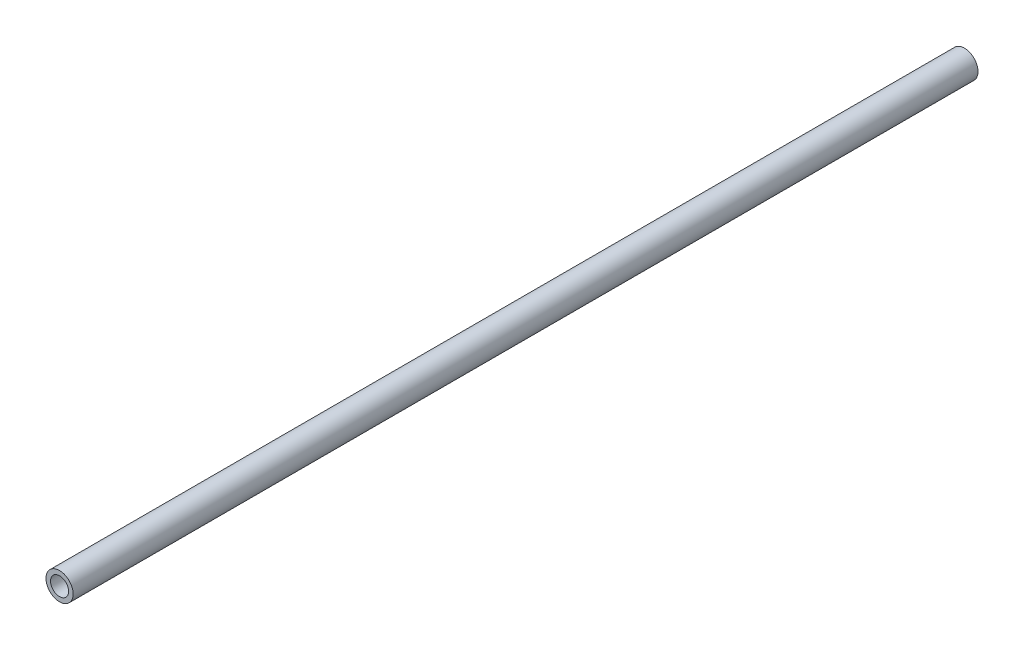
from build123d import *

# Parameters (mm, degrees)
ESQUISSE1_R        = 3
ESQUISSE1_R_2      = 2
BOSS_EXTRU_1_DEPTH = 200


with BuildPart() as part:
    # Esquisse1 → Boss.-Extru.1 (new body)
    with BuildSketch(Plane.XY):
        Circle(ESQUISSE1_R)
        Circle(ESQUISSE1_R_2, mode=Mode.SUBTRACT)
    extrude(amount=BOSS_EXTRU_1_DEPTH)


solid = part.part
